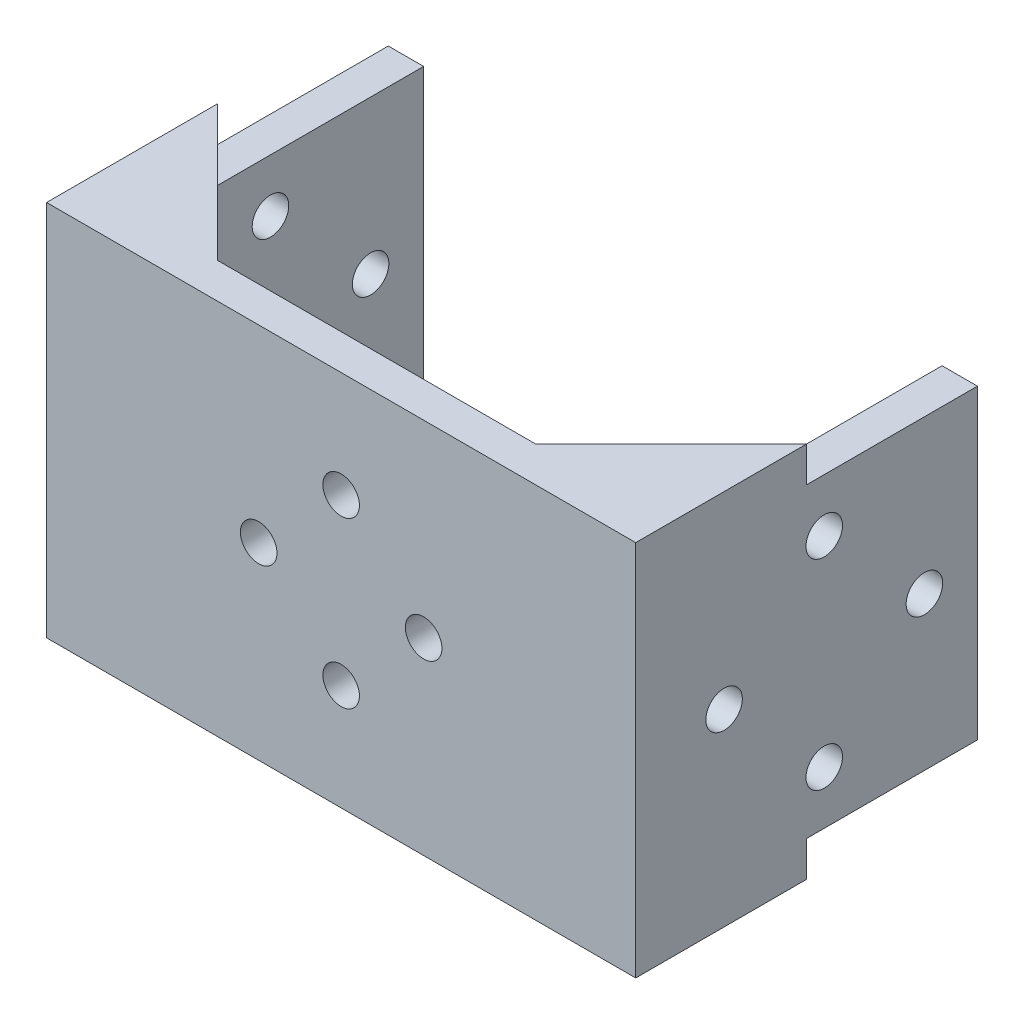
from build123d import *

# Parameters (mm, degrees)
SKETCH1_W           = 50
SKETCH1_H           = 26
SKETCH1_R           = 1.55
BOSS_EXTRUDE1_DEPTH = 3
SKETCH2_W           = 29
SKETCH2_H           = 26
SKETCH2_R           = 1.55
BOSS_EXTRUDE2_DEPTH = 3
BOSS_EXTRUDE3_START = -47
SKETCH2_2_W         = 29
SKETCH2_2_H         = 26
SKETCH2_2_R         = 1.55
BOSS_EXTRUDE3_DEPTH = 3
BOSS_EXTRUDE4_DEPTH = 3
BOSS_EXTRUDE5_START = -26
BOSS_EXTRUDE5_DEPTH = 3


with BuildPart() as part:
    # Sketch1 → Boss-Extrude1 (new body)
    with BuildSketch(Plane.XY):
        Rectangle(SKETCH1_W, SKETCH1_H)
        with Locations((-7, 0)):
            Circle(SKETCH1_R, mode=Mode.SUBTRACT)
        with Locations((0, 7)):
            Circle(SKETCH1_R, mode=Mode.SUBTRACT)
        with Locations((7, 0)):
            Circle(SKETCH1_R, mode=Mode.SUBTRACT)
        with Locations((0, -7)):
            Circle(SKETCH1_R, mode=Mode.SUBTRACT)
    extrude(amount=BOSS_EXTRUDE1_DEPTH)

    # Sketch2 → Boss-Extrude2 (add)
    with BuildSketch(Plane.ZY.offset(25)):
        with Locations((-11.5, 0)):
            Rectangle(SKETCH2_W, SKETCH2_H)
        with Locations((-4.5, 0)):
            Circle(SKETCH2_R, mode=Mode.SUBTRACT)
        with Locations((-13, -8.5)):
            Circle(SKETCH2_R, mode=Mode.SUBTRACT)
        with Locations((-21.5, 0)):
            Circle(SKETCH2_R, mode=Mode.SUBTRACT)
        with Locations((-13, 8.5)):
            Circle(SKETCH2_R, mode=Mode.SUBTRACT)
    extrude(amount=-BOSS_EXTRUDE2_DEPTH)

    # Sketch2<2> → Boss-Extrude3 (add)
    with BuildSketch(Plane.ZY.offset(25).offset(BOSS_EXTRUDE3_START)):
        with Locations((-11.5, 0)):
            Rectangle(SKETCH2_2_W, SKETCH2_2_H)
        with Locations((-4.5, 0)):
            Circle(SKETCH2_2_R, mode=Mode.SUBTRACT)
        with Locations((-13, -8.5)):
            Circle(SKETCH2_2_R, mode=Mode.SUBTRACT)
        with Locations((-21.5, 0)):
            Circle(SKETCH2_2_R, mode=Mode.SUBTRACT)
        with Locations((-13, 8.5)):
            Circle(SKETCH2_2_R, mode=Mode.SUBTRACT)
    extrude(amount=-BOSS_EXTRUDE3_DEPTH)

    # Sketch3 → Boss-Extrude4 (add)
    with BuildSketch(Plane(origin=(0, 13, 0), x_dir=(1, 0, 0), z_dir=(0, 1, 0))):
        Polygon((-25, -3), (-25, 11.5), (-13.5, 0), (13.5, 0), (25, 11.5), (25, -3), align=None)
    extrude(amount=BOSS_EXTRUDE4_DEPTH)

    # Sketch3<3> → Boss-Extrude5 (add)
    with BuildSketch(Plane(origin=(0, 13, 0), x_dir=(1, 0, 0), z_dir=(0, 1, 0)).offset(BOSS_EXTRUDE5_START)):
        Polygon((-25, -3), (-25, 11.5), (-13.5, 0), (13.5, 0), (25, 11.5), (25, -3), align=None)
    extrude(amount=-BOSS_EXTRUDE5_DEPTH)


solid = part.part
